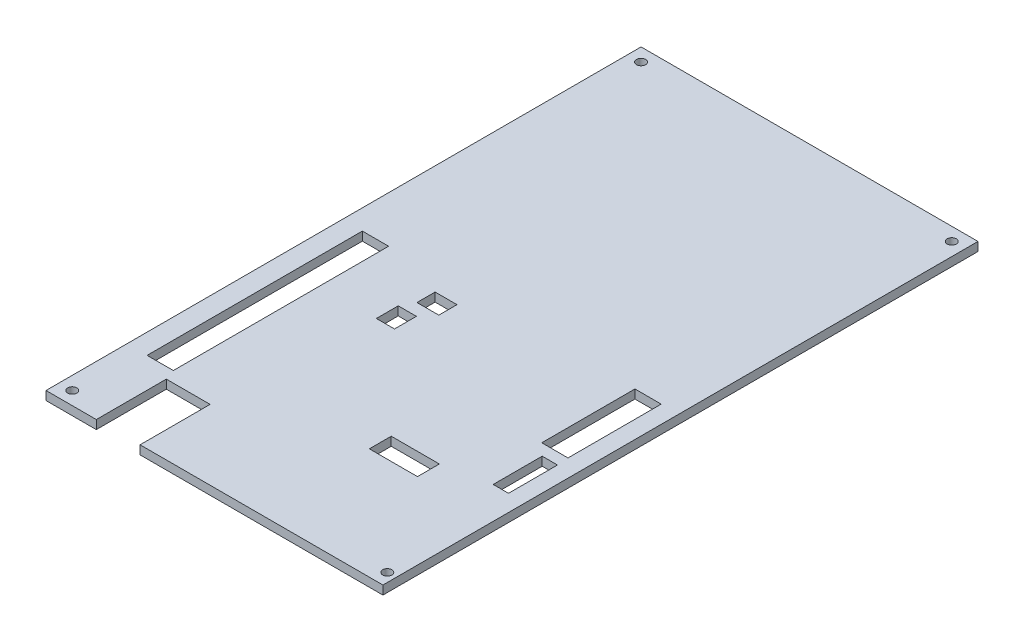
from build123d import *

# Parameters (mm, degrees)
SKETCH_2_R      = 1.05
SKETCH_2_W      = 6
SKETCH_2_H      = 49.2
SKETCH_2_W_2    = 4.15
SKETCH_2_H_2    = 5
SKETCH_2_W_3    = 5
SKETCH_2_H_3    = 4.15
SKETCH_2_W_4    = 11
SKETCH_2_W_5    = 3.5
SKETCH_2_H_4    = 11.2
SKETCH_2_H_5    = 21.3
EXTRUDE_1_DEPTH = 2


with BuildPart() as part:
    # 草图2 → 凸台-拉伸1 (new body)
    with BuildSketch(Plane(origin=(0, 0, 0), x_dir=(1, 0, 0), z_dir=(0, 1, 0))):
        Polygon((77, 0), (0, 0), (0, -136), (11.5, -136), (11.5, -120), (21.5, -120), (21.5, -136), (77, -136), align=None)
        with Locations(Location((3, -133, 0), (0, 0, 270))):
            Circle(SKETCH_2_R, mode=Mode.SUBTRACT)
        with Locations((7.6, -92.9)):
            Rectangle(SKETCH_2_W, SKETCH_2_H, mode=Mode.SUBTRACT)
        with Locations((25.575, -81.5)):
            Rectangle(SKETCH_2_W_2, SKETCH_2_H_2, mode=Mode.SUBTRACT)
        with Locations((27.48, -74.125)):
            Rectangle(SKETCH_2_W_3, SKETCH_2_H_3, mode=Mode.SUBTRACT)
        with Locations((54, -108.1)):
            Rectangle(SKETCH_2_W_4, SKETCH_2_H_2, mode=Mode.SUBTRACT)
        with Locations(Location((75, -133, 0), (0, 0, 270))):
            Circle(SKETCH_2_R, mode=Mode.SUBTRACT)
        with Locations((71.45, -97.9)):
            Rectangle(SKETCH_2_W_5, SKETCH_2_H_4, mode=Mode.SUBTRACT)
        with Locations((70, -79.05)):
            Rectangle(SKETCH_2_W, SKETCH_2_H_5, mode=Mode.SUBTRACT)
        with Locations(Location((3, -3, 0), (0, 0, 270))):
            Circle(SKETCH_2_R, mode=Mode.SUBTRACT)
        with Locations(Location((74, -3, 0), (0, 0, 270))):
            Circle(SKETCH_2_R, mode=Mode.SUBTRACT)
    extrude(amount=EXTRUDE_1_DEPTH)


solid = part.part
